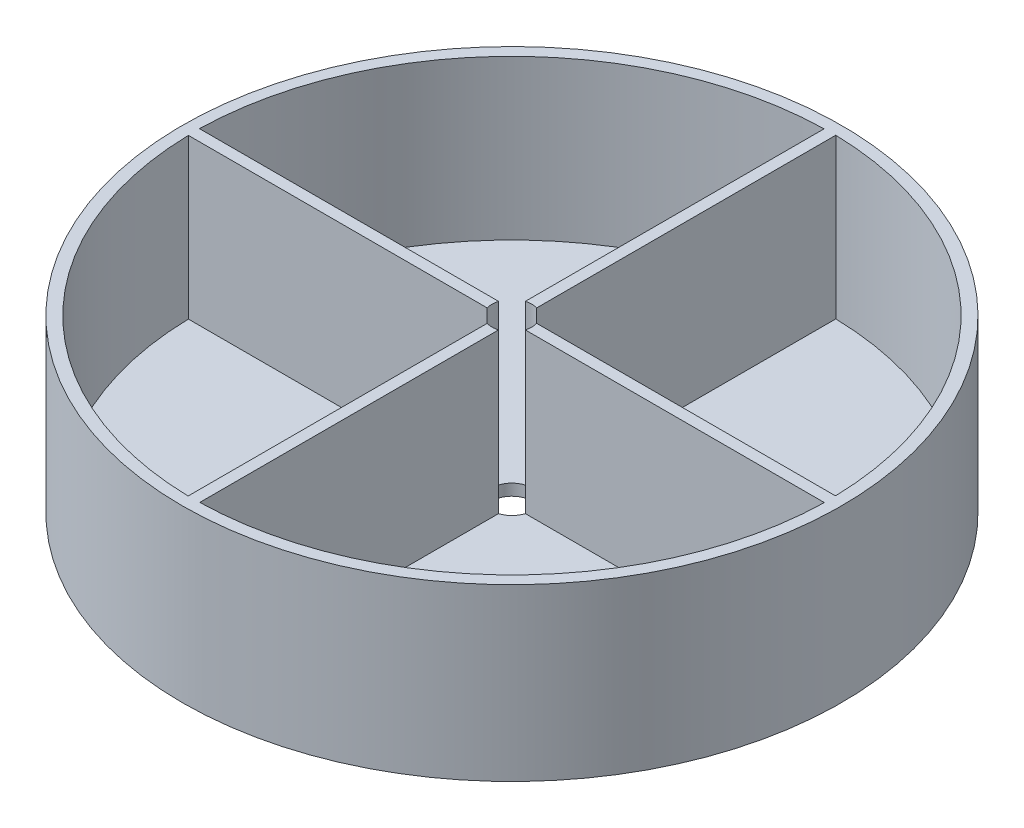
from build123d import *

# Parameters (mm, degrees)
ESQUISSE2_R              = 58
BOSS_EXTRU_2_DEPTH       = 30
ENL_V_MAT_EXTRU_2_DEPTH  = 28
ENL_V_MAT_EXTRU_3_DEPTH  = 28
ENL_V_MAT_EXTRU_8_DEPTH  = 28
ENL_V_MAT_EXTRU_10_DEPTH = 28
ESQUISSE18_R             = 3
ENL_V_MAT_EXTRU_11_DEPTH = 30
ESQUISSE21_R             = 3.5
ENL_V_MAT_EXTRU_13_DEPTH = 28
ENL_V_START              = -10
ESQUISSE22_R             = 3.5
ENL_V_MAT_EXTRU_14_DEPTH = 10


with BuildPart() as part:
    # Esquisse2 → Boss.-Extru.2 (new body)
    with BuildSketch(Plane(origin=(0, 0, 0), x_dir=(1, 0, 0), z_dir=(0, 1, 0))):
        with Locations(Location((0, 0, 0), (0, 0, 270))):
            Circle(ESQUISSE2_R)
    extrude(amount=BOSS_EXTRU_2_DEPTH)

    # Esquisse3 → Enlèv. mat.-Extru.2 (cut)
    with BuildSketch(Plane(origin=(0, 30, 0), x_dir=(1, 0, 0), z_dir=(0, 1, 0))):
        with BuildLine():
            Line((-55.99137867, 1), (-1, 1))
            Line((-1, 1), (-1, 55.940862442))
            ThreePointArc((-1, 55.940862442), (-39.531080805, 39.515969353), (-55.99137867, 1))
        make_face()
    extrude(amount=-ENL_V_MAT_EXTRU_2_DEPTH, mode=Mode.SUBTRACT)

    # Esquisse5 → Enlèv. mat.-Extru.3 (cut)
    with BuildSketch(Plane(origin=(0, 30, 0), x_dir=(1, 0, 0), z_dir=(0, 1, 0))):
        with BuildLine():
            Line((0.999998069, 55.991388398), (0.999998069, 1.000009729))
            Line((0.999998069, 1.000009729), (55.940860512, 1.000009729))
            ThreePointArc((55.940860512, 1.000009729), (39.515967422, 39.531090534), (0.999998069, 55.991388398))
        make_face()
    extrude(amount=-ENL_V_MAT_EXTRU_3_DEPTH, mode=Mode.SUBTRACT)

    # Esquisse14 → Enlèv. mat.-Extru.8 (cut)
    with BuildSketch(Plane(origin=(0, 30, 0), x_dir=(1, 0, 0), z_dir=(0, 1, 0))):
        with BuildLine():
            Line((-1.000000805, -55.991378782), (-1.000000805, -1.000000112))
            Line((-1.000000805, -1.000000112), (-55.940863247, -1.000000112))
            ThreePointArc((-55.940863247, -1.000000112), (-39.515970158, -39.531080917), (-1.000000805, -55.991378782))
        make_face()
    extrude(amount=-ENL_V_MAT_EXTRU_8_DEPTH, mode=Mode.SUBTRACT)

    # Esquisse17 → Enlèv. mat.-Extru.10 (cut)
    with BuildSketch(Plane(origin=(0, 30, 0), x_dir=(1, 0, 0), z_dir=(0, 1, 0))):
        with BuildLine():
            Line((55.991361526, -0.999992166), (0.999998069, -1.000000112))
            Line((0.999998069, -1.000000112), (0.999982856, -55.940854608))
            ThreePointArc((0.999982856, -55.940854608), (39.531063661, -39.515961519), (55.991361526, -0.999992166))
        make_face()
    extrude(amount=-ENL_V_MAT_EXTRU_10_DEPTH, mode=Mode.SUBTRACT)

    # Esquisse18 → Enlèv. mat.-Extru.11 (cut)
    with BuildSketch(Plane.XZ):
        with Locations(Location((0, 0, 0), (0, 0, 270))):
            Circle(ESQUISSE18_R)
    extrude(amount=-ENL_V_MAT_EXTRU_11_DEPTH, mode=Mode.SUBTRACT)

    # Esquisse21 → Enlèv. mat.-Extru.13 (cut)
    with BuildSketch(Plane(origin=(0, 2, 0), x_dir=(1, 0, 0), z_dir=(0, 1, 0))):
        Circle(ESQUISSE21_R)
    extrude(amount=ENL_V_MAT_EXTRU_13_DEPTH, mode=Mode.SUBTRACT)

    # Esquisse22 → Enlèv. mat.-Extru.14 (cut)
    with BuildSketch(Plane(origin=(0, 2, 0), x_dir=(1, 0, 0), z_dir=(0, 1, 0)).offset(ENL_V_START)):
        with Locations(Location((0, 0, 0), (0, 0, 73.398483382))):
            Circle(ESQUISSE22_R)
    extrude(amount=ENL_V_MAT_EXTRU_14_DEPTH, mode=Mode.SUBTRACT)


solid = part.part
